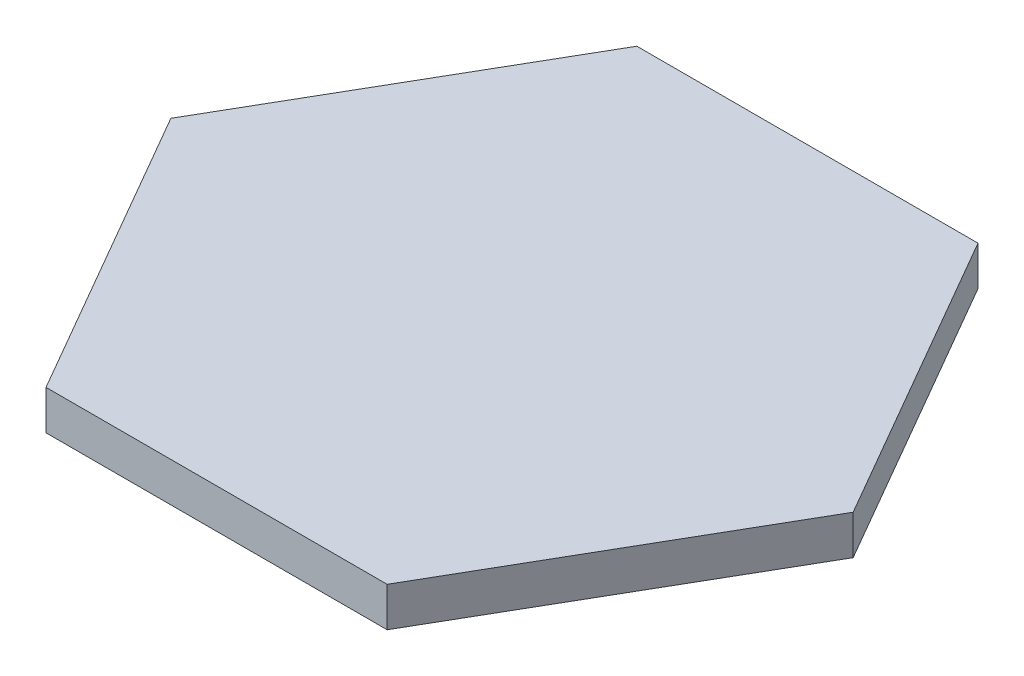
from build123d import *

# Parameters (mm, degrees)
BOSS_EXTRUDE1_DEPTH = 4


with BuildPart() as part:
    # Sketch1 → Boss-Extrude1 (new body)
    with BuildSketch(Plane(origin=(0, 0, 0), x_dir=(1, 0, 0), z_dir=(0, 1, 0))):
        Polygon((34.641016151, 0), (17.320508076, 30), (-17.320508076, 30), (-34.641016151, 0), (-17.320508076, -30), (17.320508076, -30), align=None)
    extrude(amount=BOSS_EXTRUDE1_DEPTH)


solid = part.part
